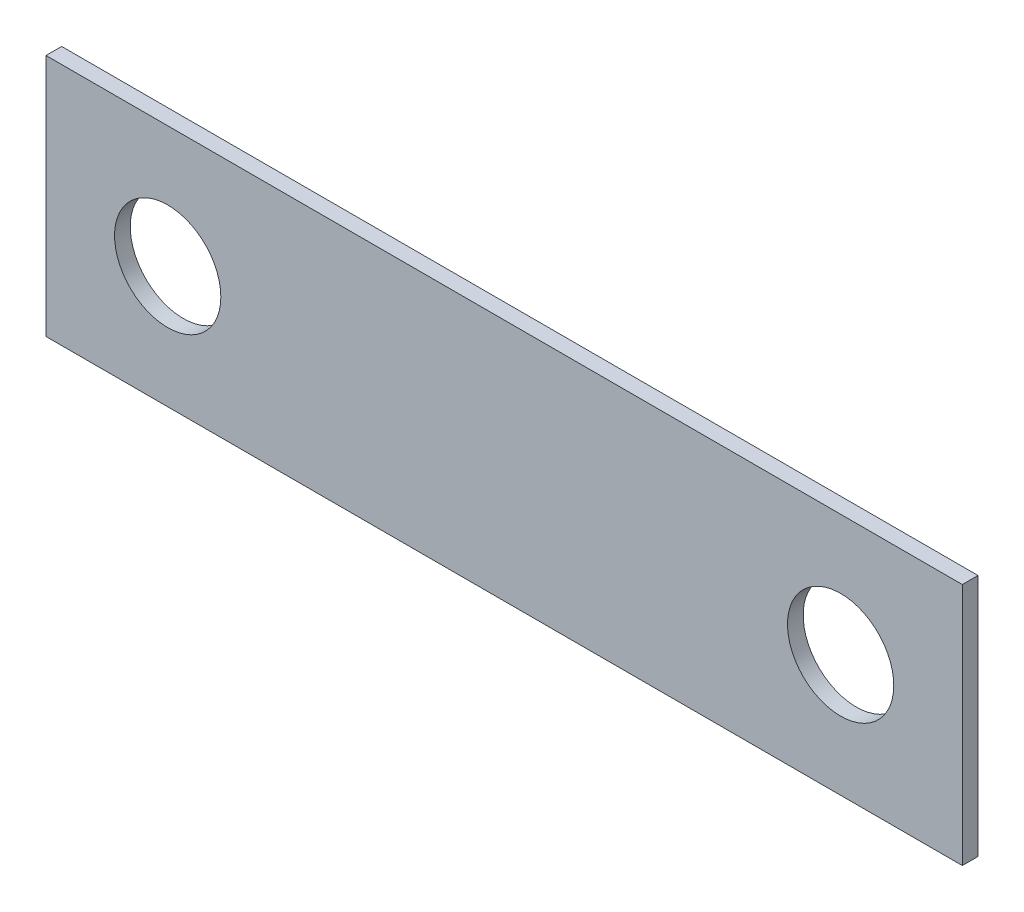
from build123d import *

# Parameters (mm, degrees)
SKETCH1_W           = 26.73
SKETCH1_H           = 7.1
SKETCH1_R           = 1.55
BOSS_EXTRUDE1_DEPTH = 0.4572


with BuildPart() as part:
    # Sketch1 → Boss-Extrude1 (new body)
    with BuildSketch(Plane.XY):
        with Locations((13.365, 3.55)):
            Rectangle(SKETCH1_W, SKETCH1_H)
        with Locations((3.55, 3.55)):
            Circle(SKETCH1_R, mode=Mode.SUBTRACT)
        with Locations((23.18, 3.55)):
            Circle(SKETCH1_R, mode=Mode.SUBTRACT)
    extrude(amount=BOSS_EXTRUDE1_DEPTH)


solid = part.part
